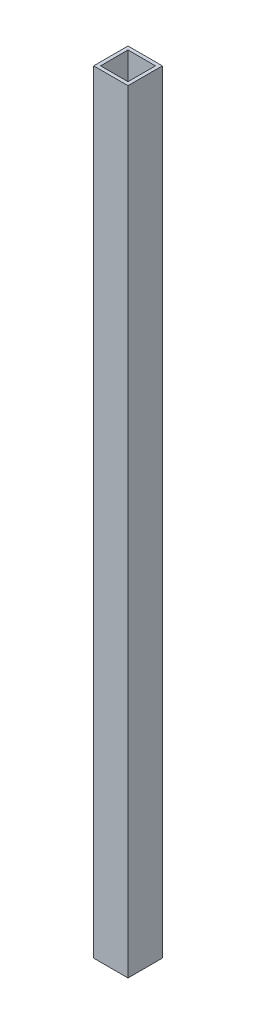
from build123d import *

# Parameters (mm, degrees)
CROQUIS1_W              = 20
CROQUIS1_H              = 20
CROQUIS1_W_2            = 16
CROQUIS1_H_2            = 16
SALIENTE_EXTRUIR1_DEPTH = 225


with BuildPart() as part:
    # Croquis1 → Saliente-Extruir1 (new, symmetric)
    with BuildSketch(Plane(origin=(0, 0, 0), x_dir=(1, 0, 0), z_dir=(0, 1, 0))):
        Rectangle(CROQUIS1_W, CROQUIS1_H)
        Rectangle(CROQUIS1_W_2, CROQUIS1_H_2, mode=Mode.SUBTRACT)
    extrude(amount=SALIENTE_EXTRUIR1_DEPTH, both=True)


solid = part.part
